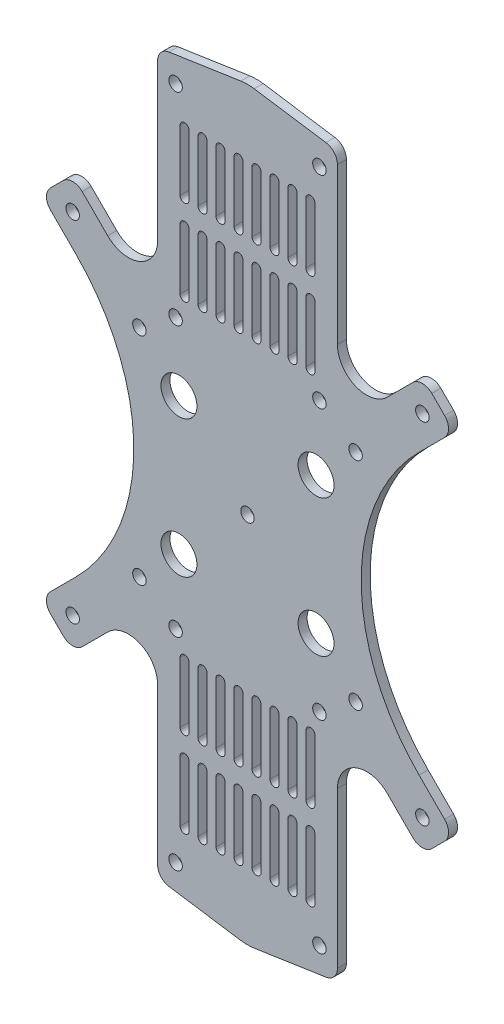
from build123d import *

# Parameters (mm, degrees)
CROQUIS1_R              = 4
CROQUIS1_R_2            = 1.5
SALIENTE_EXTRUIR1_DEPTH = 2
REDONDEO1_R             = 3
REDONDEO2_R             = 10


with BuildPart() as part:
    # Croquis1 → Saliente-Extruir1 (new body)
    with BuildSketch(Plane.XY):
        with BuildLine():
            Line((-42.426406871, 42.426406871), (-38.890872965, 45.961940777))
            Line((-38.890872965, 45.961940777), (-31.096194078, 38.16726189))
            ThreePointArc((-31.096194078, 38.16726189), (-24.01255769, 36.758239006), (-20, 42.763455967))
            Line((-20, 42.763455967), (-20, 80))
            Line((-20, 80), (0, 83))
            Line((0, 83), (20, 80))
            Line((20, 80), (20, 42.763455967))
            ThreePointArc((20, 42.763455967), (24.01255769, 36.758239006), (31.096194078, 38.16726189))
            Line((31.096194078, 38.16726189), (38.890872965, 45.961940777))
            Line((38.890872965, 45.961940777), (42.426406871, 42.426406871))
            Line((42.426406871, 42.426406871), (45.961940777, 38.890872965))
            Line((45.961940777, 38.890872965), (38.16726189, 31.096194078))
            ThreePointArc((38.16726189, 31.096194078), (25.286796564, 0), (38.16726189, -31.096194078))
            Line((38.16726189, -31.096194078), (45.961940777, -38.890872965))
            Line((45.961940777, -38.890872965), (42.426406871, -42.426406871))
            Line((42.426406871, -42.426406871), (38.890872965, -45.961940777))
            Line((38.890872965, -45.961940777), (31.096194078, -38.16726189))
            ThreePointArc((31.096194078, -38.16726189), (24.01255769, -36.758239006), (20, -42.763455967))
            Line((20, -42.763455967), (20, -80))
            Line((20, -80), (0, -83))
            Line((0, -83), (-20, -80))
            Line((-20, -80), (-20, -42.763455967))
            ThreePointArc((-20, -42.763455967), (-24.01255769, -36.758239006), (-31.096194078, -38.16726189))
            Line((-31.096194078, -38.16726189), (-38.890872965, -45.961940777))
            Line((-38.890872965, -45.961940777), (-42.426406871, -42.426406871))
            Line((-42.426406871, -42.426406871), (-45.961940777, -38.890872965))
            Line((-45.961940777, -38.890872965), (-38.16726189, -31.096194078))
            ThreePointArc((-38.16726189, -31.096194078), (-25.286796564, 0), (-38.16726189, 31.096194078))
            Line((-38.16726189, 31.096194078), (-45.961940777, 38.890872965))
            Line((-45.961940777, 38.890872965), (-42.426406871, 42.426406871))
        make_face()
        with Locations((-15.25, 15.25)):
            Circle(CROQUIS1_R, mode=Mode.SUBTRACT)
        with Locations((-24.04163056, 24.04163056)):
            Circle(CROQUIS1_R_2, mode=Mode.SUBTRACT)
        with Locations((-38.890872965, 38.890872965)):
            Circle(CROQUIS1_R_2, mode=Mode.SUBTRACT)
        with Locations(Location((38.890872965, 38.890872965, 0), (0, 0, 180))):
            Circle(CROQUIS1_R_2, mode=Mode.SUBTRACT)
        with Locations(Location((24.04163056, 24.04163056, 0), (0, 0, 180))):
            Circle(CROQUIS1_R_2, mode=Mode.SUBTRACT)
        with Locations(Location((15.25, 15.25, 0), (0, 0, 180))):
            Circle(CROQUIS1_R, mode=Mode.SUBTRACT)
        with Locations((15.25, -15.25)):
            Circle(CROQUIS1_R, mode=Mode.SUBTRACT)
        with Locations((24.04163056, -24.04163056)):
            Circle(CROQUIS1_R_2, mode=Mode.SUBTRACT)
        with Locations((38.890872965, -38.890872965)):
            Circle(CROQUIS1_R_2, mode=Mode.SUBTRACT)
        with Locations(Location((-15.25, -15.25, 0), (0, 0, 180))):
            Circle(CROQUIS1_R, mode=Mode.SUBTRACT)
        with Locations(Location((-24.04163056, -24.04163056, 0), (0, 0, 180))):
            Circle(CROQUIS1_R_2, mode=Mode.SUBTRACT)
        with Locations(Location((-38.890872965, -38.890872965, 0), (0, 0, 180))):
            Circle(CROQUIS1_R_2, mode=Mode.SUBTRACT)
        Circle(CROQUIS1_R_2, mode=Mode.SUBTRACT)
        with Locations((-16, -75)):
            Circle(CROQUIS1_R_2, mode=Mode.SUBTRACT)
        with Locations((-16, -30)):
            Circle(CROQUIS1_R_2, mode=Mode.SUBTRACT)
        with Locations(Location((-16, 30, 0), (0, 0, 180))):
            Circle(CROQUIS1_R_2, mode=Mode.SUBTRACT)
        with Locations(Location((-16, 75, 0), (0, 0, 180))):
            Circle(CROQUIS1_R_2, mode=Mode.SUBTRACT)
        with Locations(Location((16, -75, 0), (0, 0, 180))):
            Circle(CROQUIS1_R_2, mode=Mode.SUBTRACT)
        with Locations(Location((16, -30, 0), (0, 0, 180))):
            Circle(CROQUIS1_R_2, mode=Mode.SUBTRACT)
        with Locations((16, 30)):
            Circle(CROQUIS1_R_2, mode=Mode.SUBTRACT)
        with Locations((16, 75)):
            Circle(CROQUIS1_R_2, mode=Mode.SUBTRACT)
        with BuildLine():
            Line((-11, -54), (-11, -67.5))
            ThreePointArc((-11, -67.5), (-10, -68.5), (-9, -67.5))
            Line((-9, -67.5), (-9, -54))
            ThreePointArc((-9, -54), (-10, -53), (-11, -54))
        make_face(mode=Mode.SUBTRACT)
        with BuildLine():
            Line((-15, -54), (-15, -67.5))
            ThreePointArc((-15, -67.5), (-14, -68.5), (-13, -67.5))
            Line((-13, -67.5), (-13, -54))
            ThreePointArc((-13, -54), (-14, -53), (-15, -54))
        make_face(mode=Mode.SUBTRACT)
        with BuildLine():
            Line((-7, -54), (-7, -67.5))
            ThreePointArc((-7, -67.5), (-6, -68.5), (-5, -67.5))
            Line((-5, -67.5), (-5, -54))
            ThreePointArc((-5, -54), (-6, -53), (-7, -54))
        make_face(mode=Mode.SUBTRACT)
        with BuildLine():
            Line((-3, -54), (-3, -67.5))
            ThreePointArc((-3, -67.5), (-2, -68.5), (-1, -67.5))
            Line((-1, -67.5), (-1, -54))
            ThreePointArc((-1, -54), (-2, -53), (-3, -54))
        make_face(mode=Mode.SUBTRACT)
        with BuildLine():
            Line((1, -54), (1, -67.5))
            ThreePointArc((1, -67.5), (2, -68.5), (3, -67.5))
            Line((3, -67.5), (3, -54))
            ThreePointArc((3, -54), (2, -53), (1, -54))
        make_face(mode=Mode.SUBTRACT)
        with BuildLine():
            Line((5, -54), (5, -67.5))
            ThreePointArc((5, -67.5), (6, -68.5), (7, -67.5))
            Line((7, -67.5), (7, -54))
            ThreePointArc((7, -54), (6, -53), (5, -54))
        make_face(mode=Mode.SUBTRACT)
        with BuildLine():
            Line((9, -54), (9, -67.5))
            ThreePointArc((9, -67.5), (10, -68.5), (11, -67.5))
            Line((11, -67.5), (11, -54))
            ThreePointArc((11, -54), (10, -53), (9, -54))
        make_face(mode=Mode.SUBTRACT)
        with BuildLine():
            Line((13, -54), (13, -67.5))
            ThreePointArc((13, -67.5), (14, -68.5), (15, -67.5))
            Line((15, -67.5), (15, -54))
            ThreePointArc((15, -54), (14, -53), (13, -54))
        make_face(mode=Mode.SUBTRACT)
        with BuildLine():
            Line((-11, -35), (-11, -48.5))
            ThreePointArc((-11, -48.5), (-10, -49.5), (-9, -48.5))
            Line((-9, -48.5), (-9, -35))
            ThreePointArc((-9, -35), (-10, -34), (-11, -35))
        make_face(mode=Mode.SUBTRACT)
        with BuildLine():
            Line((-7, -35), (-7, -48.5))
            ThreePointArc((-7, -48.5), (-6, -49.5), (-5, -48.5))
            Line((-5, -48.5), (-5, -35))
            ThreePointArc((-5, -35), (-6, -34), (-7, -35))
        make_face(mode=Mode.SUBTRACT)
        with BuildLine():
            Line((-3, -35), (-3, -48.5))
            ThreePointArc((-3, -48.5), (-2, -49.5), (-1, -48.5))
            Line((-1, -48.5), (-1, -35))
            ThreePointArc((-1, -35), (-2, -34), (-3, -35))
        make_face(mode=Mode.SUBTRACT)
        with BuildLine():
            Line((1, -35), (1, -48.5))
            ThreePointArc((1, -48.5), (2, -49.5), (3, -48.5))
            Line((3, -48.5), (3, -35))
            ThreePointArc((3, -35), (2, -34), (1, -35))
        make_face(mode=Mode.SUBTRACT)
        with BuildLine():
            Line((5, -35), (5, -48.5))
            ThreePointArc((5, -48.5), (6, -49.5), (7, -48.5))
            Line((7, -48.5), (7, -35))
            ThreePointArc((7, -35), (6, -34), (5, -35))
        make_face(mode=Mode.SUBTRACT)
        with BuildLine():
            Line((9, -35), (9, -48.5))
            ThreePointArc((9, -48.5), (10, -49.5), (11, -48.5))
            Line((11, -48.5), (11, -35))
            ThreePointArc((11, -35), (10, -34), (9, -35))
        make_face(mode=Mode.SUBTRACT)
        with BuildLine():
            Line((13, -35), (13, -48.5))
            ThreePointArc((13, -48.5), (14, -49.5), (15, -48.5))
            Line((15, -48.5), (15, -35))
            ThreePointArc((15, -35), (14, -34), (13, -35))
        make_face(mode=Mode.SUBTRACT)
        with BuildLine():
            Line((-15, -35), (-15, -48.5))
            ThreePointArc((-15, -48.5), (-14, -49.5), (-13, -48.5))
            Line((-13, -48.5), (-13, -35))
            ThreePointArc((-13, -35), (-14, -34), (-15, -35))
        make_face(mode=Mode.SUBTRACT)
        with BuildLine():
            Line((-15, 54), (-15, 67.5))
            ThreePointArc((-15, 67.5), (-14, 68.5), (-13, 67.5))
            Line((-13, 67.5), (-13, 54))
            ThreePointArc((-13, 54), (-14, 53), (-15, 54))
        make_face(mode=Mode.SUBTRACT)
        with BuildLine():
            Line((-13, 35), (-13, 48.5))
            ThreePointArc((-13, 48.5), (-14, 49.5), (-15, 48.5))
            Line((-15, 48.5), (-15, 35))
            ThreePointArc((-15, 35), (-14, 34), (-13, 35))
        make_face(mode=Mode.SUBTRACT)
        with BuildLine():
            Line((15, 35), (15, 48.5))
            ThreePointArc((15, 48.5), (14, 49.5), (13, 48.5))
            Line((13, 48.5), (13, 35))
            ThreePointArc((13, 35), (14, 34), (15, 35))
        make_face(mode=Mode.SUBTRACT)
        with BuildLine():
            Line((11, 35), (11, 48.5))
            ThreePointArc((11, 48.5), (10, 49.5), (9, 48.5))
            Line((9, 48.5), (9, 35))
            ThreePointArc((9, 35), (10, 34), (11, 35))
        make_face(mode=Mode.SUBTRACT)
        with BuildLine():
            Line((7, 35), (7, 48.5))
            ThreePointArc((7, 48.5), (6, 49.5), (5, 48.5))
            Line((5, 48.5), (5, 35))
            ThreePointArc((5, 35), (6, 34), (7, 35))
        make_face(mode=Mode.SUBTRACT)
        with BuildLine():
            Line((3, 35), (3, 48.5))
            ThreePointArc((3, 48.5), (2, 49.5), (1, 48.5))
            Line((1, 48.5), (1, 35))
            ThreePointArc((1, 35), (2, 34), (3, 35))
        make_face(mode=Mode.SUBTRACT)
        with BuildLine():
            Line((-1, 35), (-1, 48.5))
            ThreePointArc((-1, 48.5), (-2, 49.5), (-3, 48.5))
            Line((-3, 48.5), (-3, 35))
            ThreePointArc((-3, 35), (-2, 34), (-1, 35))
        make_face(mode=Mode.SUBTRACT)
        with BuildLine():
            Line((-5, 35), (-5, 48.5))
            ThreePointArc((-5, 48.5), (-6, 49.5), (-7, 48.5))
            Line((-7, 48.5), (-7, 35))
            ThreePointArc((-7, 35), (-6, 34), (-5, 35))
        make_face(mode=Mode.SUBTRACT)
        with BuildLine():
            Line((-9, 35), (-9, 48.5))
            ThreePointArc((-9, 48.5), (-10, 49.5), (-11, 48.5))
            Line((-11, 48.5), (-11, 35))
            ThreePointArc((-11, 35), (-10, 34), (-9, 35))
        make_face(mode=Mode.SUBTRACT)
        with BuildLine():
            Line((15, 54), (15, 67.5))
            ThreePointArc((15, 67.5), (14, 68.5), (13, 67.5))
            Line((13, 67.5), (13, 54))
            ThreePointArc((13, 54), (14, 53), (15, 54))
        make_face(mode=Mode.SUBTRACT)
        with BuildLine():
            Line((11, 54), (11, 67.5))
            ThreePointArc((11, 67.5), (10, 68.5), (9, 67.5))
            Line((9, 67.5), (9, 54))
            ThreePointArc((9, 54), (10, 53), (11, 54))
        make_face(mode=Mode.SUBTRACT)
        with BuildLine():
            Line((7, 54), (7, 67.5))
            ThreePointArc((7, 67.5), (6, 68.5), (5, 67.5))
            Line((5, 67.5), (5, 54))
            ThreePointArc((5, 54), (6, 53), (7, 54))
        make_face(mode=Mode.SUBTRACT)
        with BuildLine():
            Line((3, 54), (3, 67.5))
            ThreePointArc((3, 67.5), (2, 68.5), (1, 67.5))
            Line((1, 67.5), (1, 54))
            ThreePointArc((1, 54), (2, 53), (3, 54))
        make_face(mode=Mode.SUBTRACT)
        with BuildLine():
            Line((-1, 54), (-1, 67.5))
            ThreePointArc((-1, 67.5), (-2, 68.5), (-3, 67.5))
            Line((-3, 67.5), (-3, 54))
            ThreePointArc((-3, 54), (-2, 53), (-1, 54))
        make_face(mode=Mode.SUBTRACT)
        with BuildLine():
            Line((-5, 54), (-5, 67.5))
            ThreePointArc((-5, 67.5), (-6, 68.5), (-7, 67.5))
            Line((-7, 67.5), (-7, 54))
            ThreePointArc((-7, 54), (-6, 53), (-5, 54))
        make_face(mode=Mode.SUBTRACT)
        with BuildLine():
            Line((-9, 54), (-9, 67.5))
            ThreePointArc((-9, 67.5), (-10, 68.5), (-11, 67.5))
            Line((-11, 67.5), (-11, 54))
            ThreePointArc((-11, 54), (-10, 53), (-9, 54))
        make_face(mode=Mode.SUBTRACT)
    extrude(amount=SALIENTE_EXTRUIR1_DEPTH)

    # Redondeo1
    redondeo1_edges = [part.edges().sort_by_distance(p)[0] for p in [
        (-38.890872965, 45.961940777, 1),
        (-20, 80, 1),
        (20, 80, 1),
        (38.890872965, 45.961940777, 1),
        (45.961940777, 38.890872965, 1),
        (45.961940777, -38.890872965, 1),
        (38.890872965, -45.961940777, 1),
        (20, -80, 1),
        (-20, -80, 1),
        (-38.890872965, -45.961940777, 1),
        (-45.961940777, -38.890872965, 1),
        (-45.961940777, 38.890872965, 1),
    ]]
    fillet(redondeo1_edges, radius=REDONDEO1_R)

    # Redondeo2
    redondeo2_edges = [part.edges().sort_by_distance(p)[0] for p in [
        (0, 83, 1),
        (0, -83, 1),
    ]]
    fillet(redondeo2_edges, radius=REDONDEO2_R)


solid = part.part
